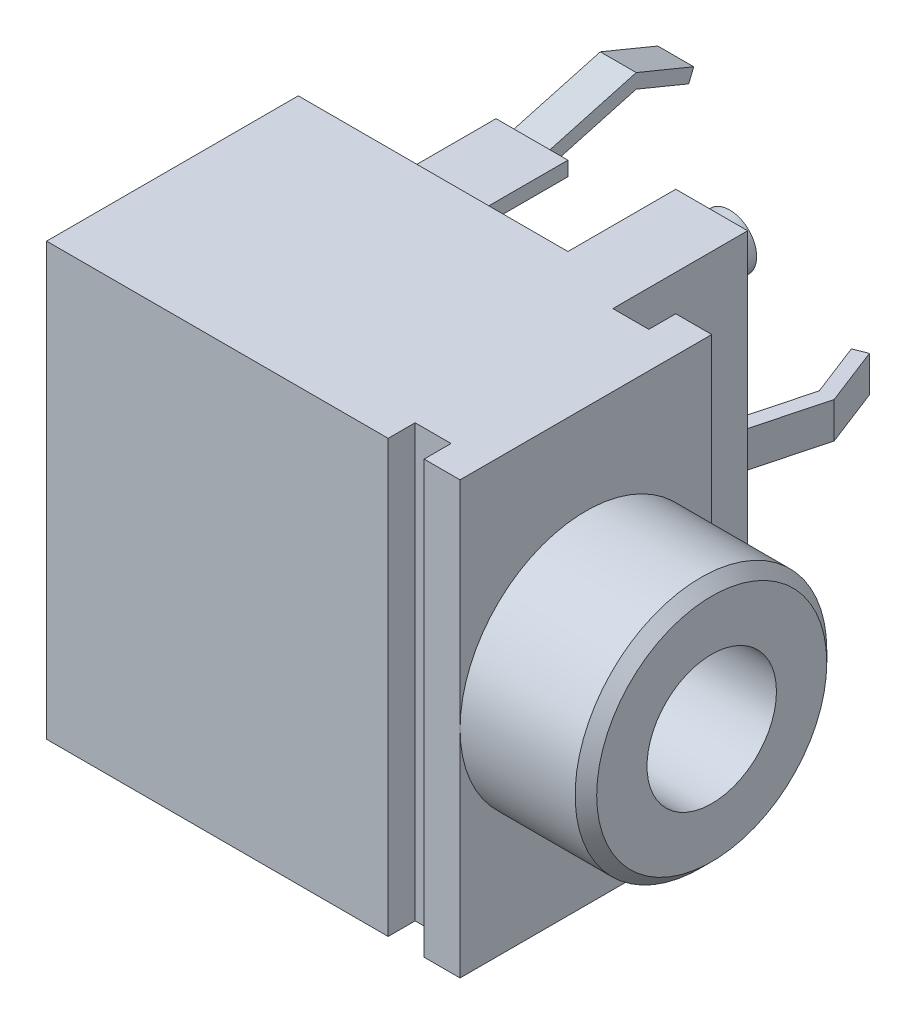
from build123d import *

# Parameters (mm, degrees)
ESBO_O1_W                        = 11.5
ESBO_O1_H                        = 12
RESSALTO_EXTRUS_O1_DEPTH         = 7
ESBO_O2_W                        = 10.5
ESBO_O2_H                        = 0.75
CORTE_EXTRUS_O1_DEPTH            = 20.52562419
ESBO_O3_W                        = 9.5
ESBO_O3_H                        = 12
RESSALTO_EXTRUS_O2_DEPTH         = 3.75
ESBO_O4_W                        = 7.5
ESBO_O4_H                        = 3
CORTE_EXTRUS_O2_DEPTH            = 21.279299791
ESBO_O5_W                        = 2
ESBO_O5_H                        = 0.4
RESSALTO_EXTRUS_O3_DEPTH         = 7
ESBO_O6_W                        = 0.5
ESBO_O6_H                        = 4
CORTE_EXTRUS_O3_DEPTH            = 21.271655088
ESBO_O7_W                        = 0.5
ESBO_O7_H                        = 4
CORTE_EXTRUS_O4_DEPTH            = 21.271655088
ESBO_O8_W                        = 4.75
ESBO_O8_H                        = 2
RESSALTO_EXTRUS_O4_DEPTH         = 3
ESBO_O9_W                        = 1
ESBO_O9_H                        = 0.75
CORTE_EXTRUS_O5_DEPTH            = 22.891779279
ESBO_O10_W                       = 2
ESBO_O10_H                       = 0.4
RESSALTO_EXTRUS_O5_DEPTH         = 3
ESBO_O11_W                       = 2
ESBO_O11_H                       = 0.4
RESSALTO_EXTRUS_O6_DEPTH         = 3
ESBO_O12_W                       = 2
ESBO_O12_H                       = 0.4
RESSALTO_EXTRUS_O7_DEPTH         = 3
ESBO_O13_W                       = 1
ESBO_O13_H                       = 0.4
RESSALTO_EXTRUS_O8_DEPTH         = 0.5
ESBO_O14_W                       = 0.75
ESBO_O14_H                       = 0.5
ESBO_O15_W                       = 0.75
ESBO_O15_H                       = 0.5
ESBO_O16_W                       = 3.5
ESBO_O16_H                       = 3.5
FURO_DE_DI_METRO_3_6_3_6_1_D     = 3.6
FURO_DE_DI_METRO_3_6_3_6_1_DEPTH = 3.5
CHANFRO1_SIZE                    = 0.3
ESBO_O19_W                       = 0.43
ESBO_O19_H                       = 1
RESSALTO_EXTRUS_O9_DEPTH         = 0.5
RESSALTO_EXTRUS_O10_DEPTH        = 0.5
RESSALTO_EXTRUS_O11_START        = -0.5
RESSALTO_EXTRUS_O11_DEPTH        = 1


with BuildPart() as part:
    # Esboço1 → Ressalto-extrusão1 (new body)
    with BuildSketch(Plane(origin=(0, 0, -3.5), x_dir=(-1, 0, 0), z_dir=(0, 0, -1))):
        with Locations((9.25, 0)):
            Rectangle(ESBO_O1_W, ESBO_O1_H)
    extrude(amount=-RESSALTO_EXTRUS_O1_DEPTH)

    # Esboço2 → Corte-extrusão1 (cut, through all)
    with BuildSketch(Plane(origin=(0, 6, 0), x_dir=(-1, 0, 0), z_dir=(0, 1, 0))):
        with Locations((9.75, -3.125)):
            Rectangle(ESBO_O2_W, ESBO_O2_H)
    extrude(amount=-CORTE_EXTRUS_O1_DEPTH, mode=Mode.SUBTRACT)

    # Esboço3 → Ressalto-extrusão2 (add)
    with BuildSketch(Plane(origin=(0, 0, -2.75), x_dir=(-1, 0, 0), z_dir=(0, 0, -1))):
        with Locations((10.25, 0)):
            Rectangle(ESBO_O3_W, ESBO_O3_H)
    extrude(amount=RESSALTO_EXTRUS_O2_DEPTH)

    # Esboço4 → Corte-extrusão2 (cut, through all)
    with BuildSketch(Plane.XZ.offset(6)):
        with Locations((-11.25, -5)):
            Rectangle(ESBO_O4_W, ESBO_O4_H)
    extrude(amount=-CORTE_EXTRUS_O2_DEPTH, mode=Mode.SUBTRACT)

    # Esboço5 → Ressalto-extrusão3 (add)
    with BuildSketch(Plane(origin=(0, 0, -3.5), x_dir=(-1, 0, 0), z_dir=(0, 0, -1))):
        with Locations((11.5, -2.5)):
            Rectangle(ESBO_O5_W, ESBO_O5_H)
    extrude(amount=RESSALTO_EXTRUS_O3_DEPTH)

    # Esboço6 → Corte-extrusão3 (cut, through all)
    with BuildSketch(Plane.XZ.offset(2.7)):
        with Locations((-10.75, -8.5)):
            Rectangle(ESBO_O6_W, ESBO_O6_H)
    extrude(amount=-CORTE_EXTRUS_O3_DEPTH, mode=Mode.SUBTRACT)

    # Esboço7 → Corte-extrusão4 (cut, through all)
    with BuildSketch(Plane.XZ.offset(2.7)):
        with Locations((-12.25, -8.5)):
            Rectangle(ESBO_O7_W, ESBO_O7_H)
    extrude(amount=-CORTE_EXTRUS_O4_DEPTH, mode=Mode.SUBTRACT)

    # Esboço8 → Ressalto-extrusão4 (add)
    with BuildSketch(Plane(origin=(0, 0, -3.5), x_dir=(-1, 0, 0), z_dir=(0, 0, -1))):
        with Locations((9.875, 0)):
            Rectangle(ESBO_O8_W, ESBO_O8_H)
    extrude(amount=RESSALTO_EXTRUS_O4_DEPTH)

    # Esboço9 → Corte-extrusão5 (cut, through all)
    with BuildSketch(Plane.XZ.offset(6)):
        with Locations((-5, 3.125)):
            Rectangle(ESBO_O9_W, ESBO_O9_H)
    extrude(amount=-CORTE_EXTRUS_O5_DEPTH, mode=Mode.SUBTRACT)

    # Esboço10 → Ressalto-extrusão5 (add)
    with BuildSketch(Plane(origin=(0, 0, -3.5), x_dir=(-1, 0, 0), z_dir=(0, 0, -1))):
        with Locations((11.5, 5)):
            Rectangle(ESBO_O10_W, ESBO_O10_H)
    extrude(amount=RESSALTO_EXTRUS_O5_DEPTH)

    # Esboço11 → Ressalto-extrusão6 (add)
    with BuildSketch(Plane(origin=(0, 0, -3.5), x_dir=(-1, 0, 0), z_dir=(0, 0, -1))):
        with Locations((11.5, -5)):
            Rectangle(ESBO_O11_W, ESBO_O11_H)
    extrude(amount=RESSALTO_EXTRUS_O6_DEPTH)

    # Esboço12 → Ressalto-extrusão7 (add)
    with BuildSketch(Plane(origin=(0, 0, -3.5), x_dir=(-1, 0, 0), z_dir=(0, 0, -1))):
        with Locations((11.5, 2.5)):
            Rectangle(ESBO_O12_W, ESBO_O12_H)
    extrude(amount=RESSALTO_EXTRUS_O7_DEPTH)

    # Esboço13 → Ressalto-extrusão8 (add)
    with BuildSketch(Plane(origin=(0, 0, -6.5), x_dir=(-1, 0, 0), z_dir=(0, 0, -1))):
        with Locations((11.5, 0)):
            Rectangle(ESBO_O13_W, ESBO_O13_H)
    extrude(amount=RESSALTO_EXTRUS_O8_DEPTH)

    # Esboço14 → Revolução1 (revolve)
    with BuildSketch(Plane(origin=(0, -5, 0), x_dir=(1, 0, 0), z_dir=(0, 1, 0))):
        with Locations((-6.125, 6.75)):
            Rectangle(ESBO_O14_W, ESBO_O14_H)
    revolve(axis=Axis((-6.5, -5, -7), (0, 0, 1)))

    # Esboço15 → Revolução2 (revolve)
    with BuildSketch(Plane(origin=(0, 5, 0), x_dir=(1, 0, 0), z_dir=(0, 1, 0))):
        with Locations((-6.125, 6.75)):
            Rectangle(ESBO_O15_W, ESBO_O15_H)
    revolve(axis=Axis((-6.5, 5, -7), (0, 0, 1)))

    # Esboço16 → Revolução3 (revolve)
    with BuildSketch(Plane(origin=(0, 0, 0), x_dir=(-1, 0, 0), z_dir=(0, 0, -1)), mode=Mode.PRIVATE) as revolu_o3_sk:
        with Locations((1.75, 1.75)):
            Rectangle(ESBO_O16_W, ESBO_O16_H)
    revolve(revolu_o3_sk.sketch.rotate(Axis((0, 0, 0), (-1, 0, 0)), 270), axis=Axis((0, 0, 0), (-1, 0, 0)))

    # Furo de diâmetro Ø3.6 (3.6)1
    with Locations(Plane(origin=(0, 0, 0), x_dir=(0, 0, -1), z_dir=(1, 0, 0))):
        with Locations((0, 0)):
            Hole(FURO_DE_DI_METRO_3_6_3_6_1_D / 2, depth=FURO_DE_DI_METRO_3_6_3_6_1_DEPTH)

    # Chanfro1
    chanfro1_edges = [part.edges().sort_by_distance(p)[0] for p in [
        (0, 0, -3.5),
    ]]
    chamfer(chanfro1_edges, length=CHANFRO1_SIZE)

    # Esboço19 → Ressalto-extrusão9 (add)
    with BuildSketch(Plane(origin=(0, 0, -6.5), x_dir=(-1, 0, 0), z_dir=(0, 0, -1))):
        with Locations((6.505, 0)):
            Rectangle(ESBO_O19_W, ESBO_O19_H)
    extrude(amount=RESSALTO_EXTRUS_O9_DEPTH)

    # Esboço20 → Ressalto-extrusão10 (add, symmetric)
    with BuildSketch(Plane(origin=(0, 0, 0), x_dir=(1, 0, 0), z_dir=(0, 1, 0))):
        Polygon((-6.302158206, 6.98750552), (-5.732158206, 9.13750552), (-6.352158206, 10.73750552), (-6.713447386, 10.597505963), (-6.147697214, 9.13750552), (-6.717697214, 6.98750552), align=None)
    extrude(amount=RESSALTO_EXTRUS_O10_DEPTH, both=True)

    # Esboço21 → Ressalto-extrusão11 (add)
    with BuildSketch(Plane.ZY.offset(12.5).offset(RESSALTO_EXTRUS_O11_START)):
        Polygon((-6.5, 5.2), (-8.9, 5.86), (-10.5, 5.2), (-10.35899319, 4.858165309), (-8.9, 5.46), (-6.5, 4.8), align=None)
    ressalto_extrus_o11 = extrude(amount=-RESSALTO_EXTRUS_O11_DEPTH)

    # Espelhar1: Ressalto-extrusão11 across plane
    add(ressalto_extrus_o11.mirror(Plane.ZX))


solid = part.part
